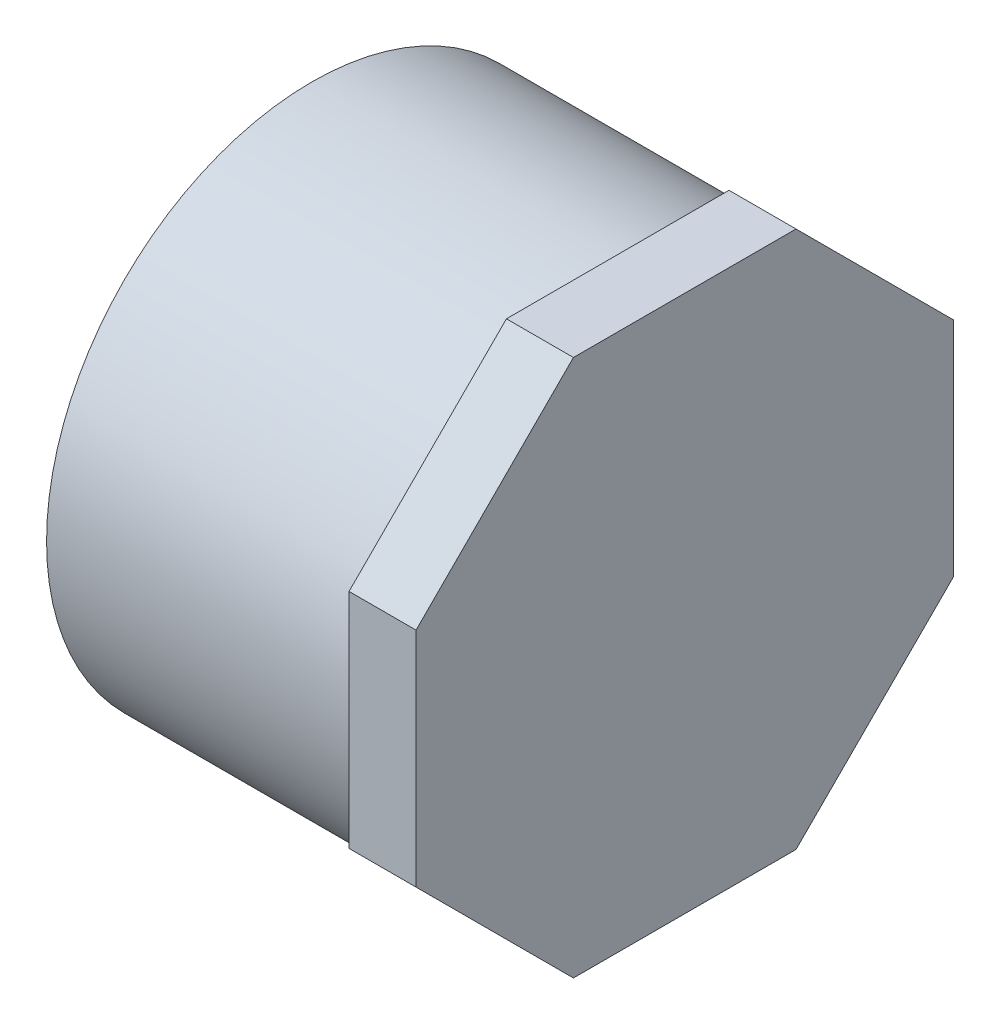
from build123d import *

# Parameters (mm, degrees)
SKETCH2_R           = 30.1625
BOSS_EXTRUDE1_DEPTH = 7.62
SCALE1_SCALE        = 0.41


with BuildPart() as part:
    # Sketch1 → Revolve1 (revolve)
    with BuildSketch(Plane.XY, mode=Mode.PRIVATE) as revolve1_sk:
        Polygon((-21.209, -30.1625), (21.209, -30.1625), (21.209, 0), (13.589, 0), (13.589, -26.2509), (-21.209, -26.2509), align=None)
    revolve(revolve1_sk.sketch.rotate(Axis((-21.209, 0, 0), (1, 0, 0)), 270), axis=Axis((-21.209, 0, 0), (1, 0, 0)))

    # Sketch2 → Boss-Extrude1 (add)
    with BuildSketch(Plane(origin=(21.209, 0, 0), x_dir=(0, 0, -1), z_dir=(1, 0, 0))):
        Polygon((-12.658107583, 30.559375), (-30.559375, 12.658107583), (-30.559375, -12.658107583), (-12.658107583, -30.559375), (12.658107583, -30.559375), (30.559375, -12.658107583), (30.559375, 12.658107583), (12.658107583, 30.559375), align=None)
        with Locations(Location((0, 0, 0), (0, 0, 180))):
            Circle(SKETCH2_R, mode=Mode.SUBTRACT)
    extrude(amount=-BOSS_EXTRUDE1_DEPTH)


with BuildPart() as part_1:
    # Scale1: scaled about (6.673848972, 0, 0)
    add(part.part.scale(SCALE1_SCALE).moved(Location((3.937570893, 0, 0))))


solid = part_1.part
